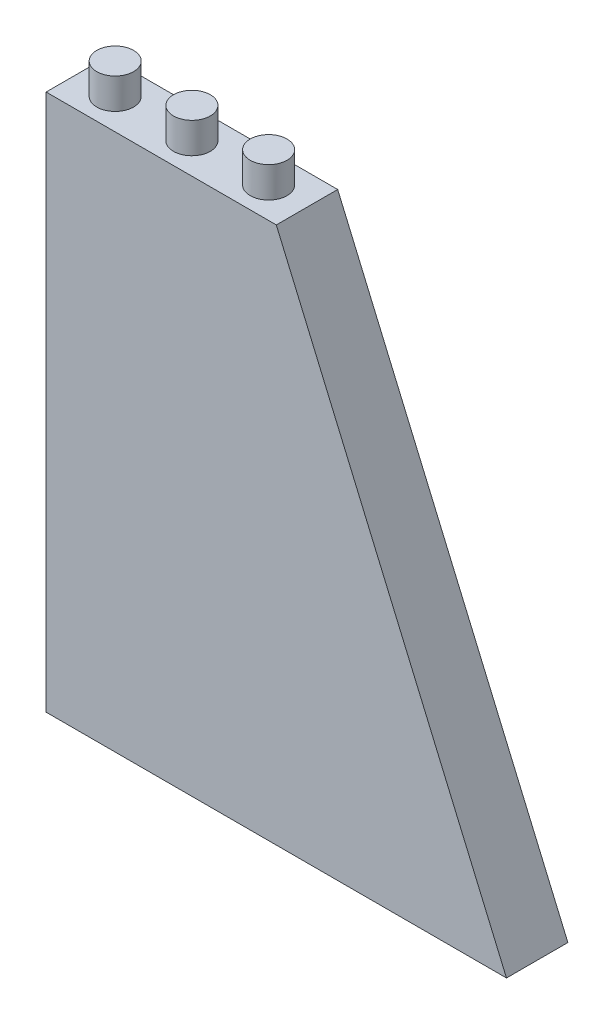
from build123d import *

# Parameters (mm, degrees)
RESSALTO_EXTRUS_O1_DEPTH = 8
ESBO_O2_R                = 2.4
RESSALTO_EXTRUS_O2_DEPTH = 4


with BuildPart() as part:
    # Esboço1 → Ressalto-extrusão1 (new body)
    with BuildSketch(Plane.XY):
        Polygon((0, 0), (0, 70), (30, 70), (60, 0), align=None)
    extrude(amount=RESSALTO_EXTRUS_O1_DEPTH)

    # Esboço2 → Ressalto-extrusão2 (add)
    with BuildSketch(Plane(origin=(0, 70, 0), x_dir=(1, 0, 0), z_dir=(0, 1, 0))):
        with Locations(Location((25, -4, 0), (0, 0, 90))):
            Circle(ESBO_O2_R)
        with Locations(Location((15, -4, 0), (0, 0, 270))):
            Circle(ESBO_O2_R)
        with Locations(Location((5, -4, 0), (0, 0, 90))):
            Circle(ESBO_O2_R)
    extrude(amount=RESSALTO_EXTRUS_O2_DEPTH)


solid = part.part
